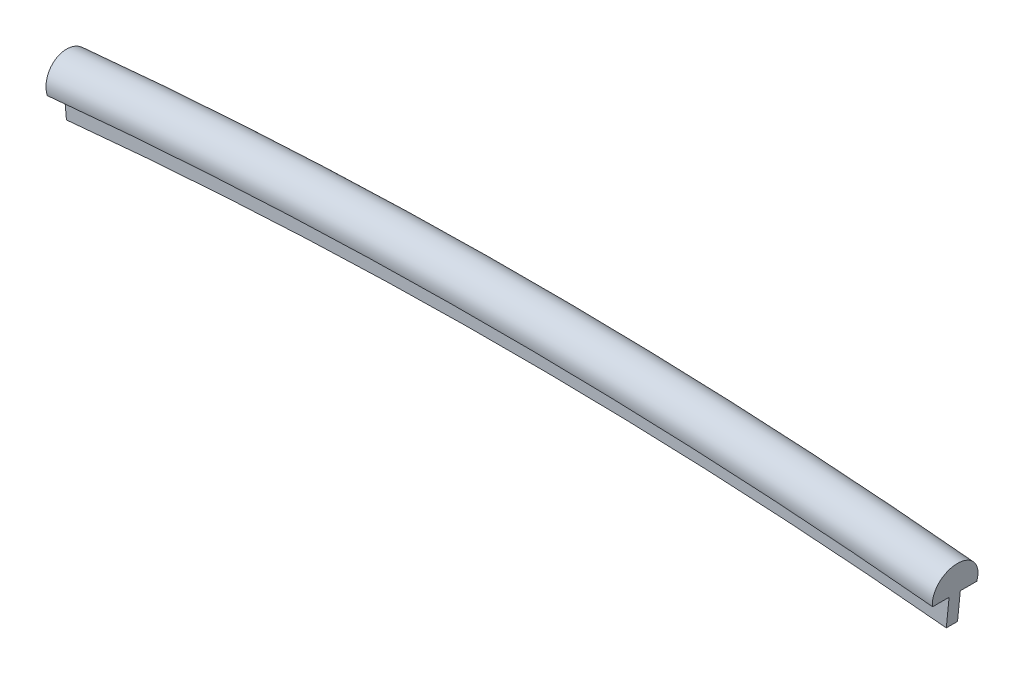
from build123d import *

# Parameters (mm, degrees)
REVOLVE1_ANGLE           = 5.631042515
REVOLVE1_OTHER_WAY_ANGLE = 5.631042515


with BuildPart() as part:
    # Sketch2 → Revolve1 (revolve)
    with BuildSketch(Plane(origin=(0, 0, 0), x_dir=(0, 0, -1), z_dir=(1, 0, 0))):
        with BuildLine():
            Line((0, 239.8), (0.3, 239.8))
            Line((0.3, 239.8), (0.3, 241.3))
            Line((0.3, 241.3), (1.18, 241.3))
            ThreePointArc((1.18, 241.3), (0, 242.800182019), (-1.18, 241.3))
            Line((-1.18, 241.3), (-0.3, 241.3))
            Line((-0.3, 241.3), (-0.3, 239.8))
            Line((-0.3, 239.8), (0, 239.8))
        make_face()
    revolve(axis=Axis((0, 0, 70.597641597), (0, 0, -1)), revolution_arc=REVOLVE1_ANGLE)

    # Sketch2 → Revolve1 other way (revolve)
    with BuildSketch(Plane(origin=(0, 0, 0), x_dir=(0, 0, -1), z_dir=(1, 0, 0))):
        with BuildLine():
            Line((0, 239.8), (0.3, 239.8))
            Line((0.3, 239.8), (0.3, 241.3))
            Line((0.3, 241.3), (1.18, 241.3))
            ThreePointArc((1.18, 241.3), (0, 242.800182019), (-1.18, 241.3))
            Line((-1.18, 241.3), (-0.3, 241.3))
            Line((-0.3, 241.3), (-0.3, 239.8))
            Line((-0.3, 239.8), (0, 239.8))
        make_face()
    revolve(axis=Axis((0, 0, 70.597641597), (0, 0, 1)), revolution_arc=REVOLVE1_OTHER_WAY_ANGLE)


solid = part.part
